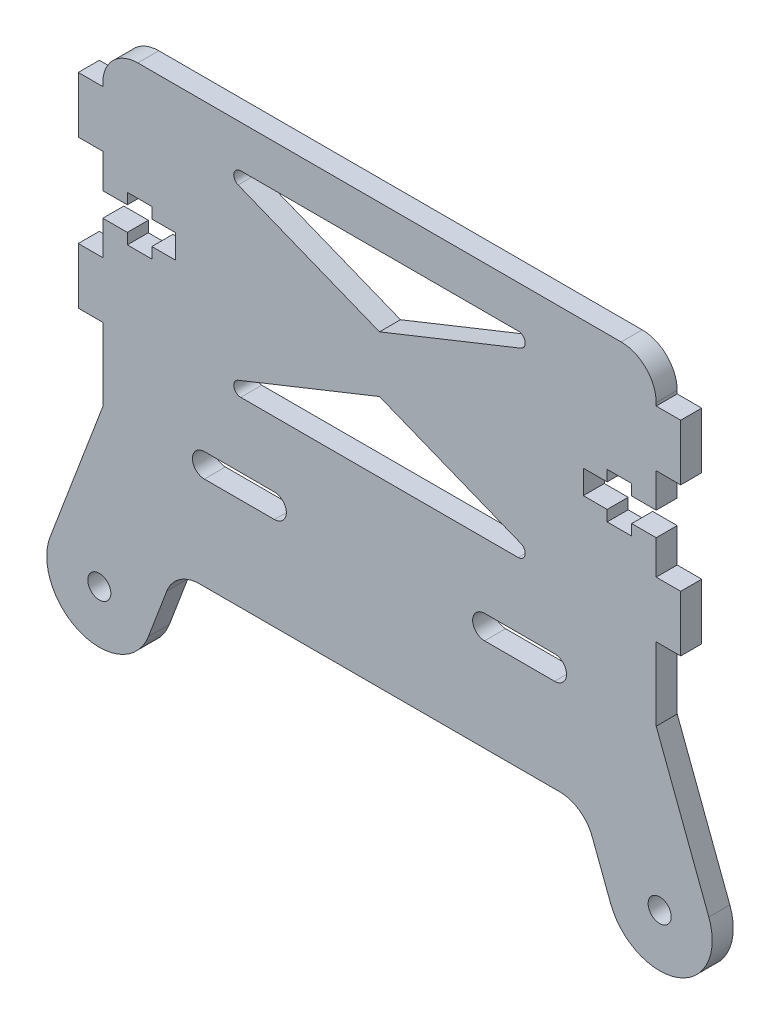
from build123d import *

# Parameters (mm, degrees)
SKETCH_1_R          = 1.65
EXTRUDE_1_DEPTH     = 3
FILLET_1_R          = 5
CUT_EXTRUDE_1_DEPTH = 111.550893257
FILLET_2_R          = 1


with BuildPart() as part:
    # 草图1 → 凸台-拉伸1 (new body)
    with BuildSketch(Plane.XY):
        with BuildLine():
            Line((7.014012459, -2.655866944), (10.859547587, 7.5))
            Line((10.859547587, 7.5), (69.140452413, 7.5))
            Line((69.140452413, 7.5), (72.985987541, -2.655866944))
            ThreePointArc((72.985987541, -2.655866944), (82.655866944, -7.014012459), (87.014012459, 2.655866944))
            Line((87.014012459, 2.655866944), (79.5, 22.5))
            Line((79.5, 22.5), (79.5, 32.925))
            Line((79.5, 32.925), (83, 32.925))
            Line((83, 32.925), (83, 40.925))
            Line((83, 40.925), (79.5, 40.925))
            Line((79.5, 40.925), (79.5, 54.075))
            Line((79.5, 54.075), (83, 54.075))
            Line((83, 54.075), (83, 62.075))
            Line((83, 62.075), (79.5, 62.075))
            Line((79.5, 62.075), (79.5, 67.5))
            Line((79.5, 67.5), (0.5, 67.5))
            Line((0.5, 67.5), (0.5, 62.075))
            Line((0.5, 62.075), (-3, 62.075))
            Line((-3, 62.075), (-3, 54.075))
            Line((-3, 54.075), (0.5, 54.075))
            Line((0.5, 54.075), (0.5, 40.925))
            Line((0.5, 40.925), (-3, 40.925))
            Line((-3, 40.925), (-3, 32.925))
            Line((-3, 32.925), (0.5, 32.925))
            Line((0.5, 32.925), (0.5, 22.5))
            Line((0.5, 22.5), (-7.014012459, 2.655866944))
            ThreePointArc((-7.014012459, 2.655866944), (-2.655866944, -7.014012459), (7.014012459, -2.655866944))
        make_face()
        Circle(SKETCH_1_R, mode=Mode.SUBTRACT)
        with Locations((80, 0)):
            Circle(SKETCH_1_R, mode=Mode.SUBTRACT)
        with BuildLine():
            Line((15, 24.2), (25, 24.2))
            ThreePointArc((25, 24.2), (26.7, 22.5), (25, 20.8))
            Line((25, 20.8), (15, 20.8))
            ThreePointArc((15, 20.8), (13.3, 22.5), (15, 24.2))
        make_face(mode=Mode.SUBTRACT)
        with BuildLine():
            Line((65, 24.2), (55, 24.2))
            ThreePointArc((55, 24.2), (53.3, 22.5), (55, 20.8))
            Line((55, 20.8), (65, 20.8))
            ThreePointArc((65, 20.8), (66.7, 22.5), (65, 24.2))
        make_face(mode=Mode.SUBTRACT)
    extrude(amount=EXTRUDE_1_DEPTH)

    # 圆角1
    fillet_1_edges = [part.edges().sort_by_distance(p)[0] for p in [
        (69.140452413, 7.5, 1.5),
        (10.859547587, 7.5, 1.5),
        (0.5, 67.5, 1.5),
        (79.5, 67.5, 1.5),
    ]]
    fillet(fillet_1_edges, radius=FILLET_1_R)

    # 草图3 → 切除-拉伸1 (cut, through all)
    with BuildSketch(Plane.XY.offset(3)):
        Polygon((0.5, 45.8), (4, 45.8), (4, 44.25), (7.5, 44.25), (7.5, 45.8), (10.9, 45.8), (10.9, 49.2), (7.5, 49.2), (7.5, 50.75), (4, 50.75), (4, 49.2), (0.5, 49.2), align=None)
        Polygon((79.5, 49.2), (76, 49.2), (76, 50.75), (72.5, 50.75), (72.5, 49.2), (69.1, 49.2), (69.1, 45.8), (72.5, 45.8), (72.5, 44.25), (76, 44.25), (76, 45.8), (79.5, 45.8), align=None)
        Polygon((40, 51.5), (15, 61.5), (65, 61.5), align=None)
        Polygon((65, 33.5), (40, 43.5), (15, 33.5), align=None)
    extrude(amount=-CUT_EXTRUDE_1_DEPTH, mode=Mode.SUBTRACT)

    # 圆角2
    fillet_2_edges = [part.edges().sort_by_distance(p)[0] for p in [
        (65, 61.5, 1.5),
        (15, 61.5, 1.5),
        (65, 33.5, 1.5),
        (15, 33.5, 1.5),
    ]]
    fillet(fillet_2_edges, radius=FILLET_2_R)


solid = part.part
